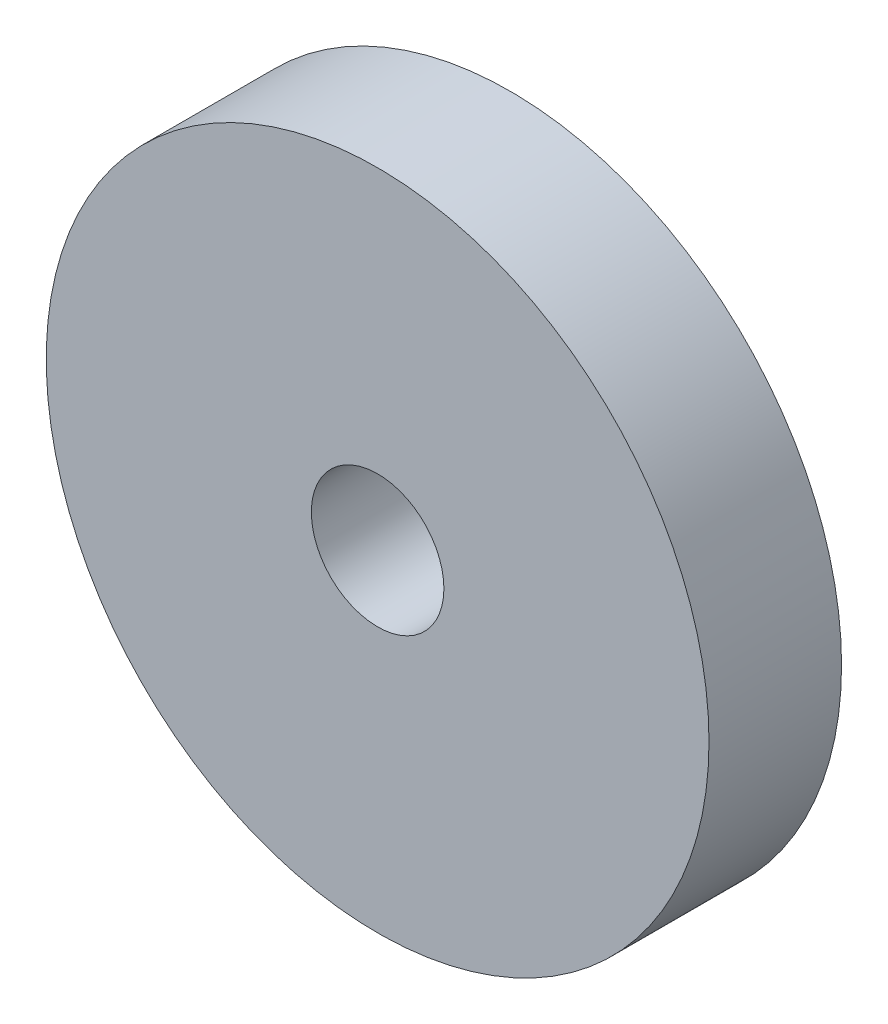
from build123d import *

# Parameters (mm, degrees)
SKETCH_1_R      = 15
SKETCH_1_R_2    = 3
EXTRUDE_1_DEPTH = 6


with BuildPart() as part:
    # 草图1 → 凸台-拉伸1 (new body)
    with BuildSketch(Plane.XY):
        Circle(SKETCH_1_R)
        Circle(SKETCH_1_R_2, mode=Mode.SUBTRACT)
    extrude(amount=EXTRUDE_1_DEPTH)


solid = part.part
